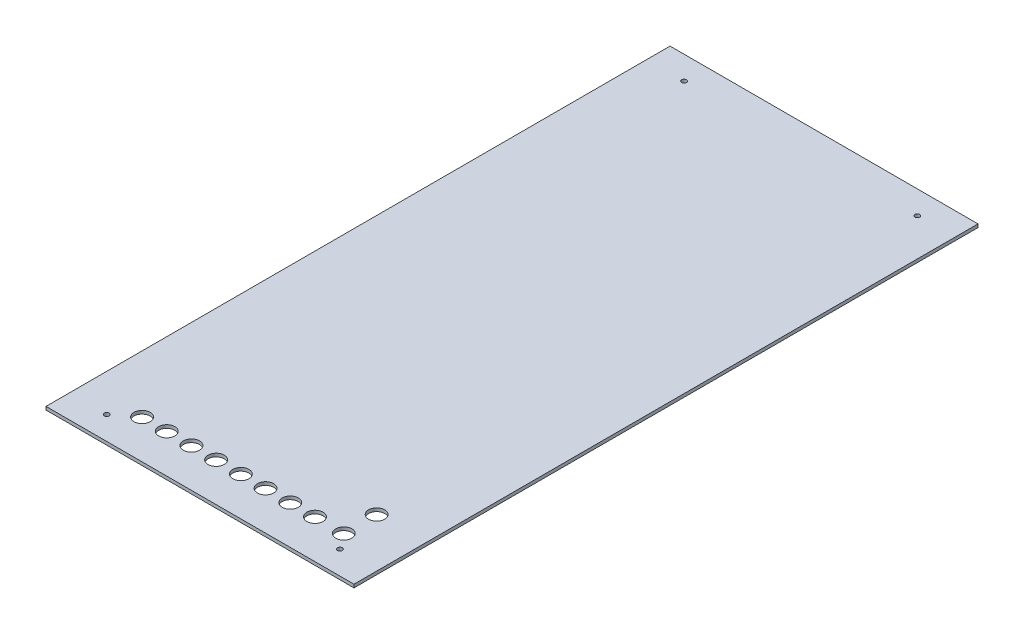
from build123d import *

# Parameters (mm, degrees)
SKETCH1_W           = 190
SKETCH1_H           = 385
SKETCH1_R           = 5
SKETCH1_R_2         = 1.5
BOSS_EXTRUDE1_DEPTH = 2


with BuildPart() as part:
    # Sketch1 → Boss-Extrude1 (new body)
    with BuildSketch(Plane(origin=(0, 0, 0), x_dir=(1, 0, 0), z_dir=(0, 1, 0))):
        Rectangle(SKETCH1_W, SKETCH1_H)
        with Locations(Location((-59.69, -168.55, 0), (0, 0, 270))):
            Circle(SKETCH1_R, mode=Mode.SUBTRACT)
        with Locations(Location((-44.45, -168.55, 0), (0, 0, 270))):
            Circle(SKETCH1_R, mode=Mode.SUBTRACT)
        with Locations(Location((-29.21, -168.55, 0), (0, 0, 270))):
            Circle(SKETCH1_R, mode=Mode.SUBTRACT)
        with Locations(Location((-13.97, -168.55, 0), (0, 0, 270))):
            Circle(SKETCH1_R, mode=Mode.SUBTRACT)
        with Locations(Location((1.27, -168.55, 0), (0, 0, 270))):
            Circle(SKETCH1_R, mode=Mode.SUBTRACT)
        with Locations(Location((16.51, -168.55, 0), (0, 0, 270))):
            Circle(SKETCH1_R, mode=Mode.SUBTRACT)
        with Locations(Location((31.75, -168.55, 0), (0, 0, 270))):
            Circle(SKETCH1_R, mode=Mode.SUBTRACT)
        with Locations(Location((46.99, -168.55, 0), (0, 0, 270))):
            Circle(SKETCH1_R, mode=Mode.SUBTRACT)
        with Locations(Location((64.77, -168.55, 0), (0, 0, 270))):
            Circle(SKETCH1_R, mode=Mode.SUBTRACT)
        with Locations(Location((64.77, -148.27, 0), (0, 0, 270))):
            Circle(SKETCH1_R, mode=Mode.SUBTRACT)
        with Locations(Location((-71.93, 178.11, 0), (0, 0, 270))):
            Circle(SKETCH1_R_2, mode=Mode.SUBTRACT)
        with Locations(Location((71.93, 178.11, 0), (0, 0, 270))):
            Circle(SKETCH1_R_2, mode=Mode.SUBTRACT)
        with Locations(Location((71.93, -178.11, 0), (0, 0, 270))):
            Circle(SKETCH1_R_2, mode=Mode.SUBTRACT)
        with Locations(Location((-71.93, -178.11, 0), (0, 0, 270))):
            Circle(SKETCH1_R_2, mode=Mode.SUBTRACT)
    extrude(amount=BOSS_EXTRUDE1_DEPTH)


solid = part.part
